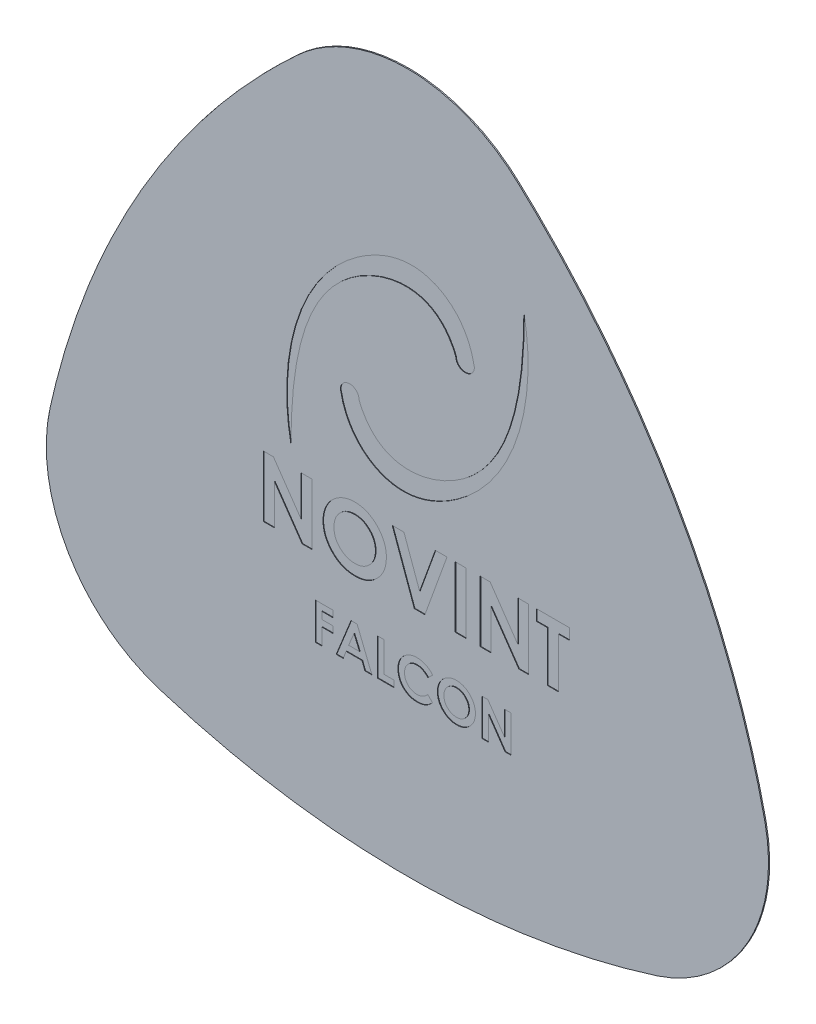
from build123d import *

# Parameters (mm, degrees)
BOSS_EXTRU_1_DEPTH      = 0.1
ESQUISSE2_W             = 0.949786325
ESQUISSE2_H             = 5.291666666
ENL_V_MAT_EXTRU_1_DEPTH = 0.05


with BuildPart() as part:
    # Esquisse1 → Boss.-Extru.1 (new body)
    with BuildSketch(Plane.XY):
        with BuildLine():
            add(Edge.make_bspline(
                [(-1e-09, 149.24999609), (-0.191850446, 149.24999609), (-0.482364619, 149.243335485), (-0.867074478, 149.224895142), (-1.226953001, 149.197576343), (-1.4756996, 149.17264382), (-2.335764991, 149.073184803), (-3.782534198, 148.789769747), (-5.861487275, 148.027713262), (-7.786555083, 146.953586168), (-8.931190465, 146.055192625), (-11.331736939, 143.853967377), (-14.902289632, 140.213201368), (-19.645187834, 134.211789539), (-23.694561542, 127.786555824), (-25.897789401, 123.306060773), (-27.336180699, 119.958079382), (-28.163686734, 117.888667417), (-29.22369016, 114.851682609), (-30.156854721, 111.736774454), (-30.717891253, 109.499484816), (-31.122190659, 107.678790325), (-31.330703598, 106.361173529), (-31.340210748, 104.086200138), (-30.931592408, 101.683245797), (-30.399513424, 100.200966244), (-29.691086056, 98.620921041), (-28.652755144, 96.82672784), (-26.480377629, 94.510099359), (-23.992041192, 92.832431733), (-22.329167896, 92.149511841), (-18.980834884, 91.095060405), (-13.920092153, 89.812269659), (-6.402453185, 88.742298167), (1.048127966, 88.467263457), (5.97213689, 88.793825688), (9.590770531, 89.222132908), (11.796687567, 89.540197635), (14.956796284, 90.140700231), (18.120969117, 90.890010258), (20.339037624, 91.522783342), (22.117955314, 92.082997128), (23.363301504, 92.561228077), (25.338239816, 93.69048138), (27.214950025, 95.245832343), (28.232602248, 96.44776599), (29.246747848, 97.85130469), (30.281399334, 99.64762231), (31.201469706, 102.687270879), (31.410204188, 105.681067264), (31.170193509, 107.462617549), (30.40920889, 110.889584012), (28.989767328, 115.913709857), (26.15757147, 122.95915997), (22.6704695, 129.549068113), (19.925655112, 133.650102873), (17.745414333, 136.569777353), (16.393454798, 138.286363566), (14.353006967, 140.66103418), (12.153490615, 143.002727038), (10.465282267, 144.648478928), (9.002860762, 145.989473228), (8.196777771, 146.647430555), (6.779267789, 147.523256047), (5.532000132, 148.137786672), (4.130695846, 148.655600121), (2.668501369, 149.019742729), (1.260112808, 149.215145885), (0.404132437, 149.24999609), (-1e-09, 149.24999609)],
                knots=[0, 0, 0, 0, 0.00212313, 0.00424626, 0.00636939, 0.00849252, 0.00849252, 0.020144411, 0.031796302, 0.043448193, 0.055100085, 0.055100085, 0.096158502, 0.13721692, 0.178275337, 0.219333755, 0.219333755, 0.238888919, 0.258444082, 0.277999246, 0.29755441, 0.29755441, 0.307312585, 0.31707076, 0.326828935, 0.33658711, 0.33658711, 0.349548682, 0.362510254, 0.375471826, 0.388433399, 0.388433399, 0.42949182, 0.470550241, 0.511608662, 0.552667084, 0.552667084, 0.572222249, 0.591777414, 0.61133258, 0.630887745, 0.630887745, 0.64064592, 0.650404095, 0.66016227, 0.669920445, 0.669920445, 0.682882017, 0.69584359, 0.708805162, 0.721766734, 0.721766734, 0.762825152, 0.803883569, 0.844941987, 0.886000404, 0.886000404, 0.905555568, 0.925110732, 0.944665896, 0.964221059, 0.964221059, 0.973165794, 0.977638162, 0.98211053, 0.986582897, 0.991055265, 0.995527632, 1, 1, 1, 1], degree=3))
        make_face()
    extrude(amount=BOSS_EXTRU_1_DEPTH)

    # Esquisse2 → Enlèv. mat.-Extru.1 (cut)
    # profile 1 of 14: a face of its own
    with BuildSketch(Plane.XY.offset(0.1)):
        with BuildLine():
            ThreePointArc((4.192087474, 129.730182633), (5.001196167, 128.92107394), (5.81030486, 129.730182633))
            add(Edge.make_bspline(
                [(5.81030486, 129.730182633), (5.24876425, 132.874810048), (1.202437213, 135.862486343), (-9.144004846, 131.067571401), (-11.280594981, 122.065551903), (-10.102166097, 115.975334856)],
                knots=[0, 0, 0, 0, 0.231487867, 0.40741182, 1, 1, 1, 1], degree=3))
            add(Edge.make_bspline(
                [(-10.102166097, 115.975334856), (-10.082531145, 120.896953893), (-9.155824834, 131.836487537), (2.42257833, 134.141709631), (4.192087474, 129.730182633)],
                knots=[0, 0, 0, 0, 0.598512938, 1, 1, 1, 1], degree=3))
        make_face()
    # profile 2 of 14: a face of its own
    with BuildSketch(Plane.XY.offset(0.1)):
        with BuildLine():
            ThreePointArc((-4.192087474, 122.269817367), (-5.001196167, 123.07892606), (-5.81030486, 122.269817367))
            add(Edge.make_bspline(
                [(-5.81030486, 122.269817367), (-5.24876425, 119.125189952), (-1.202437213, 116.137513657), (9.144004846, 120.932428599), (11.280594981, 129.934448097), (10.102166097, 136.024665144)],
                knots=[0, 0, 0, 0, 0.231487867, 0.40741182, 1, 1, 1, 1], degree=3))
            add(Edge.make_bspline(
                [(10.102166097, 136.024665144), (10.082531145, 131.103046107), (9.155824834, 120.163512463), (-2.42257833, 117.858290369), (-4.192087474, 122.269817367)],
                knots=[0, 0, 0, 0, 0.598512938, 1, 1, 1, 1], degree=3))
        make_face()
    # profile 3 of 14: a face of its own
    with BuildSketch(Plane.XY.offset(0.1)):
        Polygon((-7.982571296, 105.350933265), (-6.435776424, 105.350933265), (-6.435776424, 104.781061471), (-7.412699501, 104.781061471), (-7.412699501, 104.170484547), (-6.435776424, 104.170484547), (-6.435776424, 103.600612753), (-7.412699501, 103.600612753), (-7.412699501, 102.175933265), (-7.982571296, 102.175933265), align=None)
    # profile 4 of 14: a face of its own
    with BuildSketch(Plane.XY.offset(0.1)):
        Polygon((-4.888345535, 105.350933265), (-4.359814886, 105.350933265), (-3.077603347, 102.175933265), (-3.686272218, 102.175933265), (-3.933047057, 102.827215317), (-5.316385399, 102.827215317), (-5.563160238, 102.175933265), (-6.171193091, 102.175933265), align=None)
        Polygon((-4.624398219, 104.499305661), (-5.100139405, 103.397087112), (-4.148657033, 103.397087112), align=None, mode=Mode.SUBTRACT)
    # profile 5 of 14: a face of its own
    with BuildSketch(Plane.XY.offset(0.1)):
        Polygon((-2.609494373, 105.350933265), (-2.039622578, 105.350933265), (-2.039622578, 102.74580506), (-1.144109758, 102.74580506), (-1.144109758, 102.175933265), (-2.609494373, 102.175933265), align=None)
    # profile 6 of 14: a face of its own
    with BuildSketch(Plane.XY.offset(0.1)):
        with BuildLine():
            Line((2.193710755, 104.800141999), (1.775847173, 104.400722929))
            add(Edge.make_bspline(
                [(1.775847173, 104.400722929), (1.74040058, 104.437374766), (1.671162278, 104.508967286), (1.559593318, 104.603749473), (1.443565662, 104.682737601), (1.325336396, 104.7492609), (1.202778918, 104.799590517), (1.077310328, 104.836266557), (0.94812947, 104.858626552), (0.860704834, 104.861184931), (0.81673259, 104.862471727)],
                knots=[0, 0, 0, 0, 1.115251505, 2.178435587, 3.19620269, 4.182487026, 5.141301733, 6.088180966, 7.038406374, 8, 8, 8, 8], degree=3))
            add(Edge.make_bspline(
                [(0.81673259, 104.862471727), (0.780010423, 104.861455113), (0.707543272, 104.859448938), (0.601142504, 104.844741694), (0.499364671, 104.819731385), (0.40186137, 104.785262546), (0.30891951, 104.740661699), (0.220344227, 104.685963362), (0.136353898, 104.62166154), (0.058057988, 104.548088933), (-0.013564359, 104.467705331), (-0.076847263, 104.38193622), (-0.129856846, 104.290978092), (-0.173360948, 104.195752103), (-0.207248963, 104.095817501), (-0.231449262, 103.991241565), (-0.245446069, 103.881899754), (-0.247535186, 103.807570006), (-0.248596937, 103.769793442)],
                knots=[0, 0, 0, 0, 1.035432265, 2.043311493, 3.022114605, 3.98653278, 4.95457646, 5.923598177, 6.917315552, 7.932509744, 8.948865224, 9.949768934, 10.933144597, 11.912367597, 12.897413939, 13.903909035, 14.934704909, 16, 16, 16, 16], degree=3))
            add(Edge.make_bspline(
                [(-0.248596937, 103.769793442), (-0.248290953, 103.743279205), (-0.247687851, 103.691019101), (-0.241085836, 103.613711903), (-0.230455036, 103.538705644), (-0.215069635, 103.466113939), (-0.195830038, 103.39587388), (-0.173257611, 103.327379509), (-0.144940834, 103.261577264), (-0.113508783, 103.197702895), (-0.076953671, 103.137499294), (-0.037540516, 103.080090163), (0.005196615, 103.025756918), (0.051534535, 102.974721673), (0.10212539, 102.927781996), (0.155661595, 102.883526354), (0.213046232, 102.843062616), (0.273087275, 102.805375301), (0.336303405, 102.772636009), (0.40097942, 102.742980535), (0.46809594, 102.718895882), (0.53683578, 102.699481454), (0.606953289, 102.682972382), (0.679134281, 102.67280724), (0.752753037, 102.665109296), (0.802506959, 102.664633993), (0.82754489, 102.664394804)],
                knots=[0, 0, 0, 0, 1.103660481, 2.175337485, 3.227646561, 4.255952547, 5.262355991, 6.258840057, 7.255597736, 8.242457506, 9.22035537, 10.185017736, 11.140346927, 12.096287581, 13.051739095, 14.01125915, 14.986044842, 15.97314143, 16.960198552, 17.947847494, 18.933482797, 19.925264591, 20.920966487, 21.929612487, 22.958107872, 24, 24, 24, 24], degree=3))
            add(Edge.make_bspline(
                [(0.82754489, 102.664394804), (0.870013524, 102.665623222), (0.953453346, 102.668036745), (1.075913282, 102.686910148), (1.192605402, 102.71795583), (1.285841847, 102.754618975), (1.358890139, 102.790824307), (1.414500724, 102.824312457), (1.472006403, 102.861772629), (1.530452056, 102.90461861), (1.590495081, 102.952336233), (1.651075579, 103.005970602), (1.713744423, 103.063755614), (1.754798162, 103.104997912), (1.775847173, 103.126143602)],
                knots=[0, 0, 0, 0, 1.404581149, 2.759636711, 4.088442092, 5.392261763, 6.066678138, 6.783632037, 7.538459478, 8.336747902, 9.180226004, 10.074962426, 11.012997595, 12, 12, 12, 12], degree=3))
            Line((1.775847173, 103.126143602), (2.180990403, 102.700647809))
            add(Edge.make_bspline(
                [(2.180990403, 102.700647809), (2.152511014, 102.673151853), (2.096925339, 102.619485629), (2.013075891, 102.543284598), (1.92933197, 102.4748095), (1.847716656, 102.411574991), (1.766893005, 102.355423244), (1.686869587, 102.30629818), (1.608552303, 102.262957356), (1.53031487, 102.226131693), (1.451670453, 102.19486288), (1.37075459, 102.167942484), (1.287319914, 102.145168798), (1.200856843, 102.126793424), (1.112171852, 102.112058855), (1.020434968, 102.102113106), (0.926227848, 102.09542691), (0.862325699, 102.0948261), (0.83008896, 102.094523009)],
                knots=[0, 0, 0, 0, 1.244526981, 2.429050516, 3.560637417, 4.644440555, 5.67424972, 6.652764056, 7.595344123, 8.486817594, 9.369275933, 10.254498637, 11.166417451, 12.086725134, 13.032340136, 13.991389299, 14.986715468, 16, 16, 16, 16], degree=3))
            add(Edge.make_bspline(
                [(0.83008896, 102.094523009), (0.770874064, 102.096032515), (0.655006971, 102.098986198), (0.485206767, 102.120870991), (0.323901132, 102.157560462), (0.170697639, 102.209449492), (0.025645002, 102.275735297), (-0.111219669, 102.356998581), (-0.239675778, 102.453023441), (-0.358685654, 102.562684372), (-0.466335751, 102.683795665), (-0.56148597, 102.813835967), (-0.640194234, 102.953444379), (-0.705547402, 103.10055844), (-0.75665272, 103.255849488), (-0.7926222, 103.419485499), (-0.814804316, 103.591308475), (-0.817231071, 103.708667528), (-0.818468732, 103.768521406)],
                knots=[0, 0, 0, 0, 1.078019885, 2.10938526, 3.111377082, 4.085535484, 5.04941344, 6.010039228, 6.978205633, 7.964457913, 8.951525778, 9.924444315, 10.892603023, 11.863865945, 12.85144698, 13.863884204, 14.910567087, 16, 16, 16, 16], degree=3))
            add(Edge.make_bspline(
                [(-0.818468732, 103.768521406), (-0.817945757, 103.807557595), (-0.816909347, 103.884917781), (-0.806016587, 103.998875602), (-0.790831445, 104.109964093), (-0.766741599, 104.217029788), (-0.737703666, 104.321515059), (-0.70159118, 104.422284274), (-0.65846182, 104.519627053), (-0.609705745, 104.613706355), (-0.554548485, 104.703905857), (-0.49293177, 104.789450606), (-0.426441856, 104.87100099), (-0.353481097, 104.947475092), (-0.275109709, 105.01954437), (-0.190973854, 105.086818267), (-0.101579568, 105.150261566), (-0.006684893, 105.208238218), (0.09186662, 105.260681182), (0.192831978, 105.306938115), (0.295963119, 105.34559826), (0.400823996, 105.377665423), (0.507857646, 105.401601294), (0.616300088, 105.419719975), (0.727074039, 105.429848434), (0.80144915, 105.431506527), (0.838993207, 105.432343522)],
                knots=[0, 0, 0, 0, 1.071919942, 2.124283339, 3.142214191, 4.149696895, 5.136002878, 6.119640489, 7.086990633, 8.058538607, 9.028339693, 9.988281803, 10.952401235, 11.916291999, 12.888973767, 13.874849856, 14.873389453, 15.898127285, 16.927174885, 17.938320013, 18.946391617, 19.950418109, 20.947802303, 21.956882652, 22.968648068, 24, 24, 24, 24], degree=3))
            add(Edge.make_bspline(
                [(0.838993207, 105.432343522), (0.871022137, 105.431863736), (0.934746986, 105.430909152), (1.02964398, 105.422951658), (1.123782032, 105.410454495), (1.216824099, 105.391598936), (1.309435713, 105.369215005), (1.400399853, 105.339906336), (1.491151529, 105.3072363), (1.580267436, 105.268185943), (1.667871964, 105.225558951), (1.751912842, 105.177197081), (1.833801107, 105.126076468), (1.911722164, 105.06917157), (1.987135643, 105.008546433), (2.059647199, 104.943918208), (2.128620503, 104.874209353), (2.171904318, 104.824955931), (2.193710755, 104.800141999)],
                knots=[0, 0, 0, 0, 0.996412454, 1.982464992, 2.961075852, 3.949442424, 4.934965278, 5.923860011, 6.921385422, 7.934793307, 8.949617135, 9.951082467, 10.950285876, 11.951772932, 12.951063433, 13.960125323, 14.972308753, 16, 16, 16, 16], degree=3))
        make_face()
    # profile 7 of 14: a face of its own
    with BuildSketch(Plane.XY.offset(0.1)):
        with BuildLine():
            add(Edge.make_bspline(
                [(4.255679906, 105.432343522), (4.310881172, 105.430914262), (4.419860974, 105.42809258), (4.580130937, 105.404571656), (4.734580679, 105.366247683), (4.88314036, 105.312974589), (5.025438003, 105.243309466), (5.16197554, 105.159227369), (5.292263899, 105.059141296), (5.41496799, 104.945386091), (5.5283687, 104.821682273), (5.626630482, 104.688493121), (5.710424525, 104.549269698), (5.779873251, 104.403638951), (5.832771383, 104.250592319), (5.86989219, 104.090910137), (5.89374047, 103.924637833), (5.896483389, 103.811429057), (5.897877422, 103.753893001)],
                knots=[0, 0, 0, 0, 1.014329547, 2.002516266, 2.970391464, 3.935626869, 4.897733899, 5.877609409, 6.878433252, 7.912639331, 8.949961323, 9.958554974, 10.949718813, 11.932905612, 12.9188844, 13.919928257, 14.942845884, 16, 16, 16, 16], degree=3))
            add(Edge.make_bspline(
                [(5.897877422, 103.753893001), (5.896392837, 103.697005244), (5.893467416, 103.584906093), (5.870865782, 103.420166053), (5.833119855, 103.2621944), (5.781118917, 103.110633561), (5.712929728, 102.966217643), (5.63076976, 102.828024573), (5.532470969, 102.697336815), (5.421618698, 102.5742245), (5.299579967, 102.462473657), (5.170321577, 102.36399342), (5.034440365, 102.280544984), (4.892135216, 102.212166571), (4.743100964, 102.159100603), (4.587705742, 102.121658707), (4.425959166, 102.098904511), (4.31596365, 102.095998198), (4.260132029, 102.094523009)],
                knots=[0, 0, 0, 0, 1.051557043, 2.072126891, 3.067553643, 4.050577992, 5.02905126, 6.015227836, 7.017913613, 8.04756643, 9.074058332, 10.072836633, 11.047628519, 12.017157415, 12.98668631, 13.966869689, 14.968021931, 16, 16, 16, 16], degree=3))
            add(Edge.make_bspline(
                [(4.260132029, 102.094523009), (4.201738849, 102.095846326), (4.08700423, 102.098446464), (3.919089603, 102.123172583), (3.758212881, 102.160418756), (3.605725521, 102.216006671), (3.460074571, 102.285496239), (3.322330169, 102.371076809), (3.192538609, 102.472606951), (3.071444394, 102.587486441), (2.961732742, 102.7131898), (2.864890689, 102.845984252), (2.783202269, 102.984855363), (2.716664494, 103.129868129), (2.664208784, 103.28012133), (2.627207241, 103.436530051), (2.605349547, 103.598719169), (2.602304897, 103.708881259), (2.600762037, 103.764705301)],
                knots=[0, 0, 0, 0, 1.067978421, 2.098431617, 3.099715153, 4.085208694, 5.062210972, 6.048429807, 7.046490867, 8.072918869, 9.098532598, 10.095778865, 11.076610158, 12.041847152, 13.011192615, 13.984257998, 14.978533688, 16, 16, 16, 16], degree=3))
            add(Edge.make_bspline(
                [(2.600762037, 103.764705301), (2.601246275, 103.802260793), (2.602208621, 103.876896239), (2.61380108, 103.987502161), (2.630490888, 104.095949204), (2.655174323, 104.201804987), (2.685158388, 104.305816275), (2.724006979, 104.407014904), (2.76822719, 104.506481955), (2.819894342, 104.603042596), (2.877343219, 104.695808389), (2.940025059, 104.784341742), (3.008097475, 104.867572157), (3.081341182, 104.946046591), (3.160008588, 105.019249224), (3.243064905, 105.088216342), (3.332120942, 105.151115933), (3.425227541, 105.209484131), (3.521859789, 105.26226548), (3.621624305, 105.307191386), (3.722465743, 105.346424414), (3.825731208, 105.377388855), (3.930314028, 105.402609068), (4.037331458, 105.419287628), (4.145816656, 105.430879766), (4.218971913, 105.431854445), (4.255679906, 105.432343522)],
                knots=[0, 0, 0, 0, 1.034744296, 2.056386356, 3.06226378, 4.057406941, 5.050368692, 6.043467995, 7.042652155, 8.049140477, 9.059438543, 10.048523776, 11.036952808, 12.020949711, 13.004946614, 13.997082645, 14.994316842, 16.007702937, 17.024872941, 18.026463647, 19.021641123, 20.005082605, 20.995858141, 21.984425357, 22.988620895, 24, 24, 24, 24], degree=3))
        make_face()
        with BuildLine():
            add(Edge.make_bspline(
                [(4.246775659, 104.862471727), (4.209625214, 104.861474897), (4.136305102, 104.859507554), (4.028757851, 104.844519059), (3.925508692, 104.82058073), (3.827129975, 104.785906353), (3.73319532, 104.74177467), (3.643538209, 104.688339885), (3.559400207, 104.623765235), (3.479659416, 104.551517447), (3.407626733, 104.471016806), (3.343983585, 104.38474668), (3.290724521, 104.292851136), (3.246119721, 104.196183864), (3.212542193, 104.093657865), (3.188625926, 103.986076237), (3.173511738, 103.873253611), (3.171606576, 103.796342574), (3.170633832, 103.757073089)],
                knots=[0, 0, 0, 0, 1.033739768, 2.040188636, 3.016340934, 3.979330865, 4.937572243, 5.900995986, 6.878200029, 7.884839167, 8.891893314, 9.879764717, 10.863503415, 11.843163062, 12.837761627, 13.859916423, 14.907309254, 16, 16, 16, 16], degree=3))
            add(Edge.make_bspline(
                [(3.170633832, 103.757073089), (3.171923542, 103.713553667), (3.174451159, 103.62826281), (3.192235783, 103.503842806), (3.222663505, 103.38634046), (3.266600543, 103.27633046), (3.321093997, 103.172591227), (3.388766219, 103.076394232), (3.468521238, 102.987163493), (3.529963858, 102.935066871), (3.561148656, 102.908625573)],
                knots=[0, 0, 0, 0, 1.078454662, 2.113592447, 3.107694534, 4.079536787, 5.043276885, 6.005368276, 6.987637804, 8, 8, 8, 8], degree=3))
            add(Edge.make_bspline(
                [(3.561148656, 102.908625573), (3.586694958, 102.889091758), (3.637212001, 102.850464228), (3.7178482, 102.800955124), (3.800887607, 102.758520883), (3.886956858, 102.724234519), (3.975874179, 102.697265441), (4.067627378, 102.678379439), (4.162086448, 102.666526839), (4.225964098, 102.665110229), (4.258223976, 102.664394804)],
                knots=[0, 0, 0, 0, 1.023928204, 2.024787132, 3.009472467, 3.9914905, 4.972207045, 5.96565515, 6.972602802, 8, 8, 8, 8], degree=3))
            add(Edge.make_bspline(
                [(4.258223976, 102.664394804), (4.294735618, 102.665400086), (4.366573422, 102.667378009), (4.472118623, 102.682181987), (4.573234132, 102.707235663), (4.670547681, 102.741605864), (4.763778662, 102.786291658), (4.85247143, 102.841383823), (4.936781488, 102.906205898), (5.01642069, 102.979402459), (5.089214686, 103.060220216), (5.152725024, 103.146950498), (5.20767746, 103.237682379), (5.251354702, 103.333700029), (5.286258803, 103.434097087), (5.309887225, 103.539318191), (5.325129093, 103.648929578), (5.327034792, 103.723524001), (5.328005627, 103.761525213)],
                knots=[0, 0, 0, 0, 1.026359118, 2.019393844, 2.989460624, 3.950973911, 4.916101784, 5.890408035, 6.881132271, 7.902007068, 8.92769091, 9.933912415, 10.920395702, 11.90457117, 12.894218921, 13.903490204, 14.931958862, 16, 16, 16, 16], degree=3))
            add(Edge.make_bspline(
                [(5.328005627, 103.761525213), (5.327001201, 103.799307907), (5.325024142, 103.873677378), (5.310194108, 103.983006955), (5.285299316, 104.087763538), (5.250825905, 104.188118206), (5.206805183, 104.284169343), (5.152369096, 104.375579177), (5.087708651, 104.462259337), (5.014312006, 104.54361913), (4.934424269, 104.618383569), (4.8486568, 104.683265511), (4.759409471, 104.739645855), (4.664634512, 104.783811941), (4.566270939, 104.818998967), (4.463718532, 104.844911199), (4.356588868, 104.859402259), (4.283706343, 104.861439451), (4.246775659, 104.862471727)],
                knots=[0, 0, 0, 0, 1.055025985, 2.07665775, 3.074803781, 4.057872707, 5.035505728, 6.020516407, 7.023567878, 8.050795229, 9.077271434, 10.074415901, 11.050397877, 12.019801805, 12.988065821, 13.964604439, 14.968634123, 16, 16, 16, 16], degree=3))
        make_face(mode=Mode.SUBTRACT)
    # profile 8 of 14: a face of its own
    with BuildSketch(Plane.XY.offset(0.1)):
        Polygon((6.467749217, 105.350933265), (6.981015443, 105.350933265), (8.421595371, 103.261615357), (8.421595371, 105.350933265), (8.991467165, 105.350933265), (8.991467165, 102.175933265), (8.474384834, 102.175933265), (7.037621012, 104.258890998), (7.037621012, 102.175933265), (6.467749217, 102.175933265), align=None)
    # profile 9 of 14: a face of its own
    with BuildSketch(Plane.XY.offset(0.1)):
        Polygon((-12.474125736, 114.287130633), (-11.618682026, 114.287130633), (-9.21771548, 110.804934119), (-9.21771548, 114.287130633), (-8.267929155, 114.287130633), (-8.267929155, 108.995463967), (-9.129733041, 108.995463967), (-11.524339411, 112.467060187), (-11.524339411, 108.995463967), (-12.474125736, 108.995463967), align=None)
    # profile 10 of 14: a face of its own
    with BuildSketch(Plane.XY.offset(0.1)):
        with BuildLine():
            add(Edge.make_bspline(
                [(-4.559946382, 114.422814394), (-4.467944272, 114.420432295), (-4.286311268, 114.415729491), (-4.019194664, 114.376527951), (-3.761778427, 114.312654663), (-3.514178958, 114.223866172), (-3.27701622, 114.107757635), (-3.049453659, 113.967620805), (-2.832306394, 113.800810684), (-2.627799575, 113.611218676), (-2.438798391, 113.405045646), (-2.275028755, 113.183063725), (-2.135372018, 112.951024687), (-2.01962414, 112.708306776), (-1.931460587, 112.453229056), (-1.869592575, 112.187092086), (-1.829845442, 111.909971579), (-1.82527391, 111.721290285), (-1.822950522, 111.625396859)],
                knots=[0, 0, 0, 0, 1.014329547, 2.002516266, 2.970391464, 3.935626869, 4.897733899, 5.877609409, 6.878433252, 7.912639331, 8.949961323, 9.958554974, 10.949718813, 11.932905612, 12.9188844, 13.919928257, 14.942845884, 16, 16, 16, 16], degree=3))
            add(Edge.make_bspline(
                [(-1.822950522, 111.625396859), (-1.82542483, 111.53058393), (-1.830300533, 111.343752013), (-1.867969923, 111.06918528), (-1.9308798, 110.805899191), (-2.01754803, 110.553297792), (-2.131196679, 110.312604597), (-2.268129958, 110.082282813), (-2.431961276, 109.864469882), (-2.616715062, 109.659282691), (-2.820112947, 109.473031287), (-3.035543596, 109.308897558), (-3.262012284, 109.16981683), (-3.499187532, 109.05585281), (-3.747577952, 108.96740953), (-4.006569989, 108.90500637), (-4.276147616, 108.867082709), (-4.459473476, 108.862238854), (-4.552526177, 108.859780206)],
                knots=[0, 0, 0, 0, 1.051557043, 2.072126891, 3.067553643, 4.050577992, 5.02905126, 6.015227836, 7.017913613, 8.04756643, 9.074058332, 10.072836633, 11.047628519, 12.017157415, 12.98668631, 13.966869689, 14.968021931, 16, 16, 16, 16], degree=3))
            add(Edge.make_bspline(
                [(-4.552526177, 108.859780206), (-4.649848144, 108.861985735), (-4.841072508, 108.866319297), (-5.12093022, 108.907529495), (-5.38905809, 108.969606451), (-5.64320369, 109.062252976), (-5.885955274, 109.178068923), (-6.115529276, 109.320703205), (-6.331848544, 109.489920109), (-6.533672236, 109.681385926), (-6.716524989, 109.890891524), (-6.87792841, 110.11221561), (-7.014075776, 110.343667463), (-7.124972069, 110.585355405), (-7.212398252, 110.835777407), (-7.27406749, 111.09645861), (-7.310496981, 111.366773806), (-7.315571397, 111.55037729), (-7.31814283, 111.643417359)],
                knots=[0, 0, 0, 0, 1.067978421, 2.098431617, 3.099715153, 4.085208694, 5.062210972, 6.048429807, 7.046490867, 8.072918869, 9.098532598, 10.095778865, 11.076610158, 12.041847152, 13.011192615, 13.984257998, 14.978533688, 16, 16, 16, 16], degree=3))
            add(Edge.make_bspline(
                [(-7.31814283, 111.643417359), (-7.317335766, 111.706009846), (-7.315731858, 111.830402257), (-7.296411092, 112.014745459), (-7.268594745, 112.19549053), (-7.227455686, 112.371916836), (-7.177482245, 112.545268983), (-7.112734593, 112.713933365), (-7.039034243, 112.879711782), (-6.952922322, 113.040646184), (-6.857174193, 113.19525584), (-6.75270446, 113.342811428), (-6.639250434, 113.481528787), (-6.517177589, 113.612319509), (-6.386065245, 113.734323897), (-6.247638051, 113.849269094), (-6.099211323, 113.954101746), (-5.944033657, 114.051382076), (-5.782979911, 114.139350991), (-5.616705717, 114.214227501), (-5.448636654, 114.279615881), (-5.276527545, 114.331223282), (-5.102222845, 114.373256971), (-4.923860463, 114.40105457), (-4.743051799, 114.420374801), (-4.62112637, 114.421999266), (-4.559946382, 114.422814394)],
                knots=[0, 0, 0, 0, 1.034744296, 2.056386356, 3.06226378, 4.057406941, 5.050368692, 6.043467995, 7.042652155, 8.049140477, 9.059438543, 10.048523776, 11.036952808, 12.020949711, 13.004946614, 13.997082645, 14.994316842, 16.007702937, 17.024872941, 18.026463647, 19.021641123, 20.005082605, 20.995858141, 21.984425357, 22.988620895, 24, 24, 24, 24], degree=3))
        make_face()
        with BuildLine():
            add(Edge.make_bspline(
                [(-4.574786794, 113.473028069), (-4.636704202, 113.471366686), (-4.758904388, 113.468087781), (-4.938149807, 113.443106957), (-5.110231739, 113.403209741), (-5.274196266, 113.345419112), (-5.430754025, 113.271866308), (-5.580182544, 113.182808332), (-5.720412547, 113.075183916), (-5.853313865, 112.954770935), (-5.973368337, 112.820603201), (-6.079440251, 112.676819657), (-6.168205357, 112.523660418), (-6.24254669, 112.362548298), (-6.298509238, 112.191671633), (-6.338369682, 112.012368919), (-6.363559995, 111.824331209), (-6.366735266, 111.696146147), (-6.368356505, 111.630697006)],
                knots=[0, 0, 0, 0, 1.033739768, 2.040188636, 3.016340934, 3.979330865, 4.937572243, 5.900995986, 6.878200029, 7.884839167, 8.891893314, 9.879764717, 10.863503415, 11.843163062, 12.837761627, 13.859916423, 14.907309254, 16, 16, 16, 16], degree=3))
            add(Edge.make_bspline(
                [(-6.368356505, 111.630697006), (-6.366206989, 111.558164636), (-6.361994293, 111.416013207), (-6.332353253, 111.208646534), (-6.281640384, 111.012809291), (-6.208411987, 110.829459291), (-6.117589564, 110.656560569), (-6.004802528, 110.496232244), (-5.871877496, 110.347514346), (-5.769473128, 110.260686642), (-5.717498466, 110.216617813)],
                knots=[0, 0, 0, 0, 1.078454662, 2.113592447, 3.107694534, 4.079536787, 5.043276885, 6.005368276, 6.987637804, 8, 8, 8, 8], degree=3))
            add(Edge.make_bspline(
                [(-5.717498466, 110.216617813), (-5.674921295, 110.184061454), (-5.590726223, 110.119682238), (-5.456332559, 110.037167064), (-5.317933548, 109.96644333), (-5.174484796, 109.909299389), (-5.02628926, 109.864350925), (-4.873367262, 109.832874255), (-4.715935479, 109.813119923), (-4.60947273, 109.810758906), (-4.555706265, 109.809566531)],
                knots=[0, 0, 0, 0, 1.023928204, 2.024787132, 3.009472467, 3.9914905, 4.972207045, 5.96565515, 6.972602802, 8, 8, 8, 8], degree=3))
            add(Edge.make_bspline(
                [(-4.555706265, 109.809566531), (-4.494853528, 109.811242), (-4.375123855, 109.81453854), (-4.199215186, 109.839211836), (-4.030689339, 109.880967962), (-3.868500091, 109.938251632), (-3.713115122, 110.012727954), (-3.565293842, 110.104548229), (-3.424777079, 110.212585021), (-3.292045075, 110.334579289), (-3.170721749, 110.469275551), (-3.064871186, 110.613826021), (-2.973283793, 110.765045822), (-2.900488389, 110.925075239), (-2.842314888, 111.09240367), (-2.802934184, 111.267772176), (-2.77753107, 111.450457821), (-2.774354905, 111.574781859), (-2.772736847, 111.638117212)],
                knots=[0, 0, 0, 0, 1.026359118, 2.019393844, 2.989460624, 3.950973911, 4.916101784, 5.890408035, 6.881132271, 7.902007068, 8.92769091, 9.933912415, 10.920395702, 11.90457117, 12.894218921, 13.903490204, 14.931958862, 16, 16, 16, 16], degree=3))
            add(Edge.make_bspline(
                [(-2.772736847, 111.638117212), (-2.77441089, 111.701088368), (-2.777705989, 111.825037487), (-2.802422712, 112.007253449), (-2.843914031, 112.181847754), (-2.901369718, 112.349105534), (-2.974737586, 112.509190763), (-3.065464399, 112.661540486), (-3.173231807, 112.806007419), (-3.295559549, 112.941607075), (-3.428705777, 113.066214472), (-3.571651558, 113.174351042), (-3.720397107, 113.268318283), (-3.878355372, 113.341928426), (-4.042294661, 113.40057347), (-4.213215339, 113.443760522), (-4.391764779, 113.467912289), (-4.513235654, 113.471307609), (-4.574786794, 113.473028069)],
                knots=[0, 0, 0, 0, 1.055025985, 2.07665775, 3.074803781, 4.057872707, 5.035505728, 6.020516407, 7.023567878, 8.050795229, 9.077271434, 10.074415901, 11.050397877, 12.019801805, 12.988065821, 13.964604439, 14.968634123, 16, 16, 16, 16], degree=3))
        make_face(mode=Mode.SUBTRACT)
    # profile 11 of 14: a face of its own
    with BuildSketch(Plane.XY.offset(0.1)):
        Polygon((-1.31413642, 114.287130633), (-0.299688303, 114.287130633), (1.060329392, 110.528266451), (2.423527175, 114.287130633), (3.434795204, 114.287130633), (1.516142026, 108.995463967), (0.60133667, 108.995463967), align=None)
    # profile 12 of 14: a face of its own
    with BuildSketch(Plane.XY.offset(0.1)):
        with Locations((4.622028111, 111.6412973)):
            Rectangle(ESQUISSE2_W, ESQUISSE2_H)
    # profile 13 of 14: a face of its own
    with BuildSketch(Plane.XY.offset(0.1)):
        Polygon((6.318075119, 114.287130633), (7.173518829, 114.287130633), (9.574485375, 110.804934119), (9.574485375, 114.287130633), (10.5242717, 114.287130633), (10.5242717, 108.995463967), (9.662467814, 108.995463967), (7.267861443, 112.467060187), (7.267861443, 108.995463967), (6.318075119, 108.995463967), align=None)
    # profile 14 of 14: a face of its own
    with BuildSketch(Plane.XY.offset(0.1)):
        Polygon((11.202690503, 114.287130633), (14.052049478, 114.287130633), (14.052049478, 113.337344308), (13.102263153, 113.337344308), (13.102263153, 108.995463967), (12.152476828, 108.995463967), (12.152476828, 113.337344308), (11.202690503, 113.337344308), align=None)
    extrude(amount=-ENL_V_MAT_EXTRU_1_DEPTH, mode=Mode.SUBTRACT)


solid = part.part
